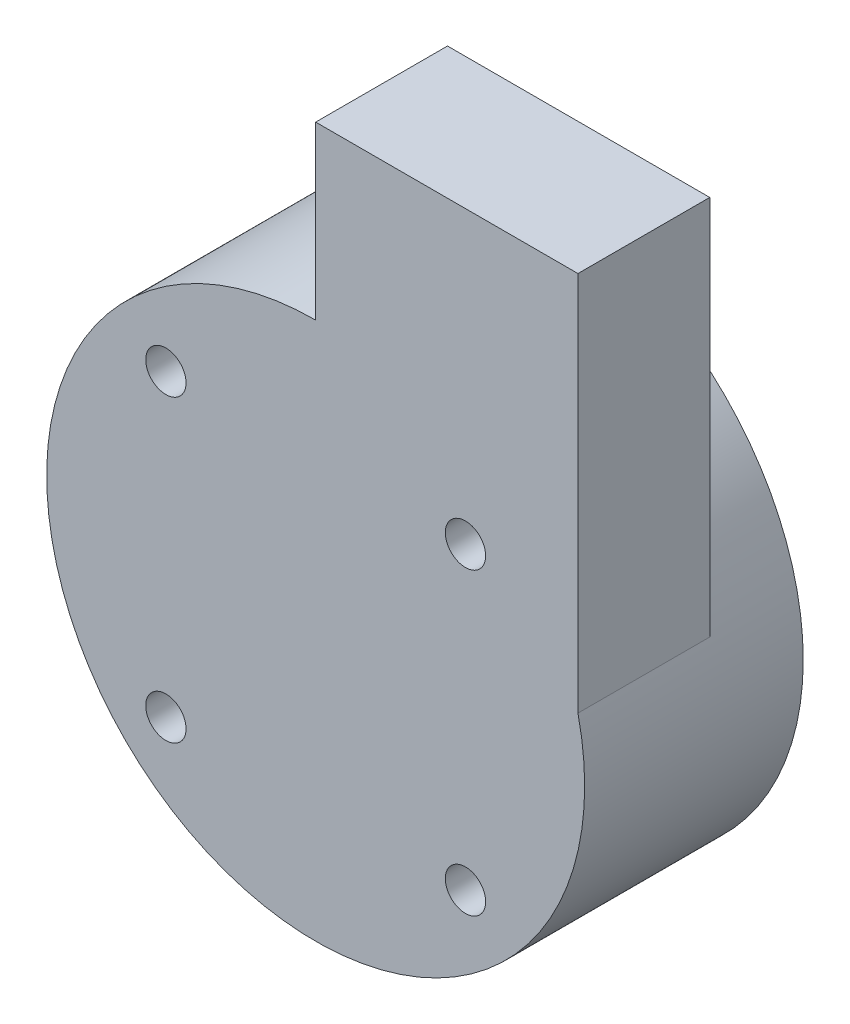
from build123d import *

# Parameters (mm, degrees)
SKETCH_1_R          = 40
SKETCH_1_R_2        = 3
EXTRUDE_1_DEPTH     = 32.5
SKETCH_3_W          = 19.6
SKETCH_3_H          = 65.5
EXTRUDE_2_DEPTH     = 39
SKETCH_4_R          = 3
CUT_EXTRUDE_2_DEPTH = 57


with BuildPart() as part:
    # 草图1 → 凸台-拉伸1 (new body)
    with BuildSketch(Plane.XY):
        Circle(SKETCH_1_R)
        with Locations((-22.273863607, 22.273863607)):
            Circle(SKETCH_1_R_2, mode=Mode.SUBTRACT)
        with Locations((22.273863607, 22.273863607)):
            Circle(SKETCH_1_R_2, mode=Mode.SUBTRACT)
        with Locations((22.273863607, -22.273863607)):
            Circle(SKETCH_1_R_2, mode=Mode.SUBTRACT)
        with Locations((-22.273863607, -22.273863607)):
            Circle(SKETCH_1_R_2, mode=Mode.SUBTRACT)
    extrude(amount=EXTRUDE_1_DEPTH)

    # 草图3 → 凸台-拉伸2 (add)
    with BuildSketch(Plane(origin=(0, 0, 0), x_dir=(0, 0, -1), z_dir=(1, 0, 0))):
        with Locations((-22.7, 32.75)):
            Rectangle(SKETCH_3_W, SKETCH_3_H)
    extrude(amount=EXTRUDE_2_DEPTH)

    # 草图4 → 切除-拉伸2 (cut)
    with BuildSketch(Plane.XY):
        with Locations((22.273863607, 22.273863607)):
            Circle(SKETCH_4_R)
    extrude(amount=CUT_EXTRUDE_2_DEPTH, mode=Mode.SUBTRACT)


solid = part.part
